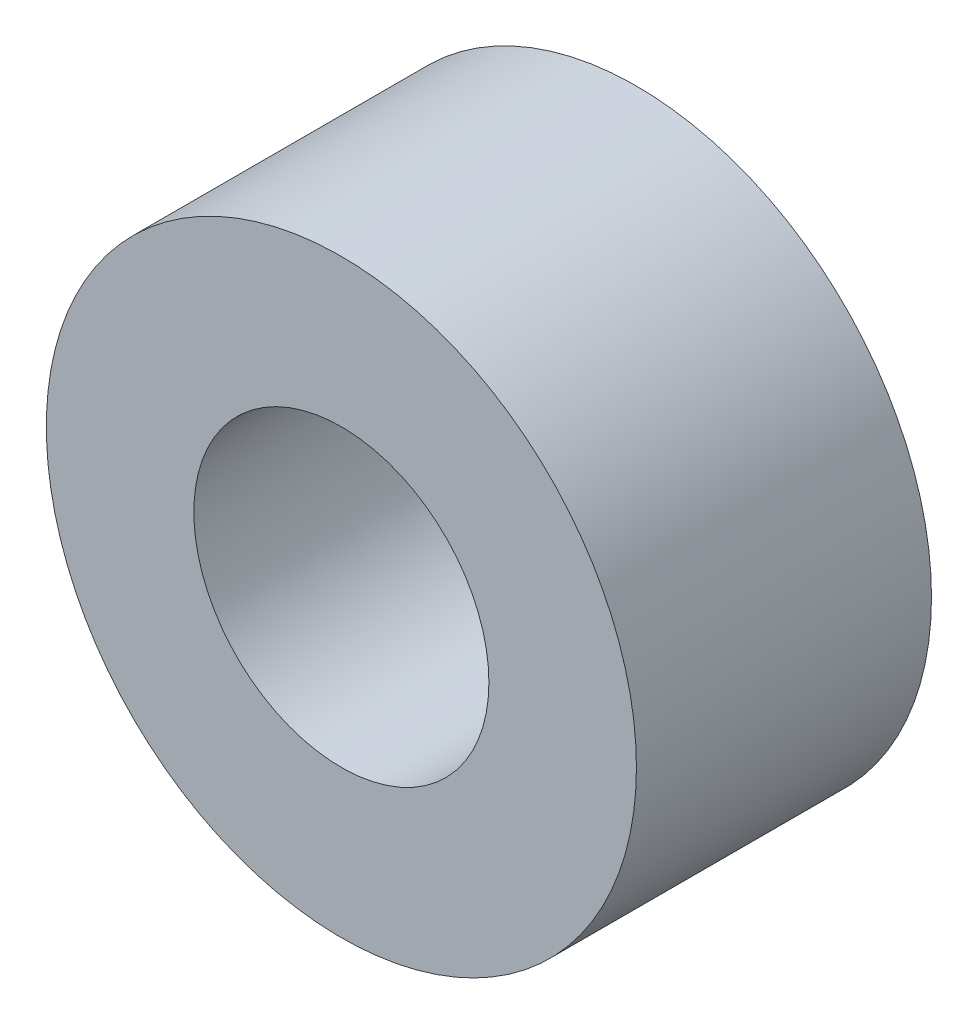
from build123d import *

# Parameters (mm, degrees)
CROQUIS1_R              = 10
SALIENTE_EXTRUIR1_DEPTH = 5
CROQUIS2_R              = 5
CORTAR_EXTRUIR1_DEPTH   = 18.320508076


with BuildPart() as part:
    # Croquis1 → Saliente-Extruir1 (new, symmetric)
    with BuildSketch(Plane.XY):
        Circle(CROQUIS1_R)
    extrude(amount=SALIENTE_EXTRUIR1_DEPTH, both=True)

    # Croquis2 → Cortar-Extruir1 (cut, through all)
    with BuildSketch(Plane.XY.offset(5)):
        Circle(CROQUIS2_R)
    extrude(amount=-CORTAR_EXTRUIR1_DEPTH, mode=Mode.SUBTRACT)


solid = part.part
